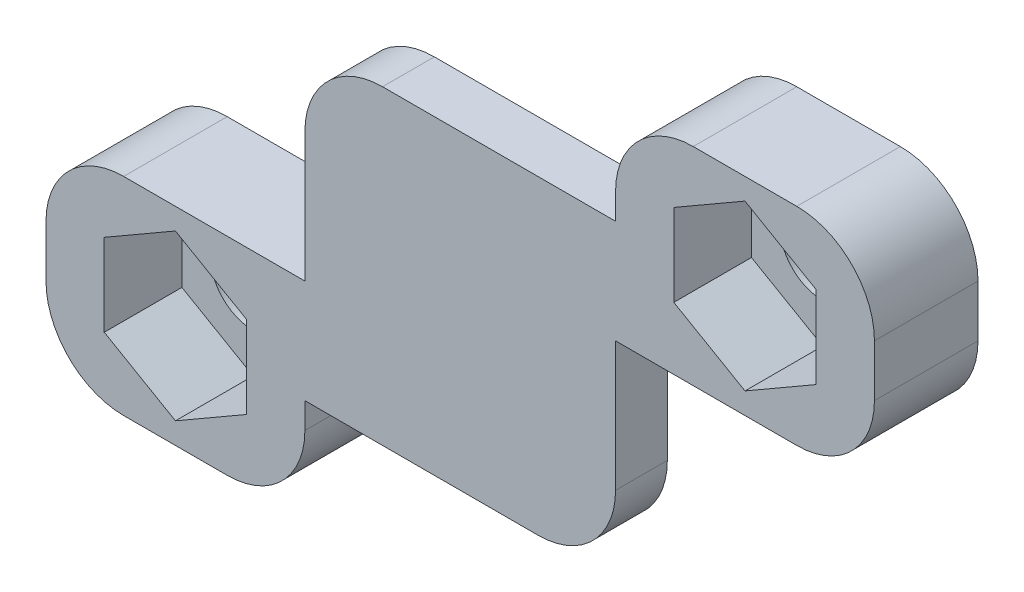
from build123d import *

# Parameters (mm, degrees)
SKETCH7_R           = 1.65
SKETCH7_W           = 12
SKETCH7_H           = 12
BOSS_EXTRUDE2_DEPTH = 4
CUT_EXTRUDE6_DEPTH  = 3
FILLET3_R           = 3
SKETCH10_W          = 12
SKETCH10_H          = 12
CUT_EXTRUDE7_DEPTH  = 2


with BuildPart() as part:
    # Sketch7 → Boss-Extrude2 (new body)
    # profile 1 of 3: a face of its own
    with BuildSketch(Plane.XY):
        Polygon((-6, -10), (-6, -6), (-6, -2), (-16, -2), (-16, -10), align=None)
        with Locations((-11, -6)):
            Circle(SKETCH7_R, mode=Mode.SUBTRACT)
    # profile 2 of 3: a face of its own
    with BuildSketch(Plane.XY):
        Rectangle(SKETCH7_W, SKETCH7_H)
    # profile 3 of 3: a face of its own
    with BuildSketch(Plane.XY):
        Polygon((6, 6), (6, 2), (16, 2), (16, 10), (6, 10), align=None)
        with Locations((11, 6)):
            Circle(SKETCH7_R, mode=Mode.SUBTRACT)
    extrude(amount=BOSS_EXTRUDE2_DEPTH)

    # Sketch9 → Cut-Extrude6 (cut)
    with BuildSketch(Plane.XY.offset(4)):
        Polygon((-11, -2.824573519), (-13.75, -4.41228676), (-13.75, -7.58771324), (-11, -9.175426481), (-8.25, -7.58771324), (-8.25, -4.41228676), align=None)
        Polygon((11, 2.824573519), (13.75, 4.41228676), (13.75, 7.58771324), (11, 9.175426481), (8.25, 7.58771324), (8.25, 4.41228676), align=None)
    extrude(amount=-CUT_EXTRUDE6_DEPTH, mode=Mode.SUBTRACT)

    # Fillet3
    fillet3_edges = [part.edges().sort_by_distance(p)[0] for p in [
        (-16, -2, 2),
        (-6, 6, 2),
        (6, 10, 2),
        (16, 10, 2),
        (16, 2, 2),
        (6, -6, 2),
        (-6, -10, 2),
        (-16, -10, 2),
    ]]
    fillet(fillet3_edges, radius=FILLET3_R)

    # Sketch10 → Cut-Extrude7 (cut)
    with BuildSketch(Plane(origin=(0, 0, 0), x_dir=(-1, 0, 0), z_dir=(0, 0, -1))):
        Rectangle(SKETCH10_W, SKETCH10_H)
    extrude(amount=-CUT_EXTRUDE7_DEPTH, mode=Mode.SUBTRACT)


solid = part.part
